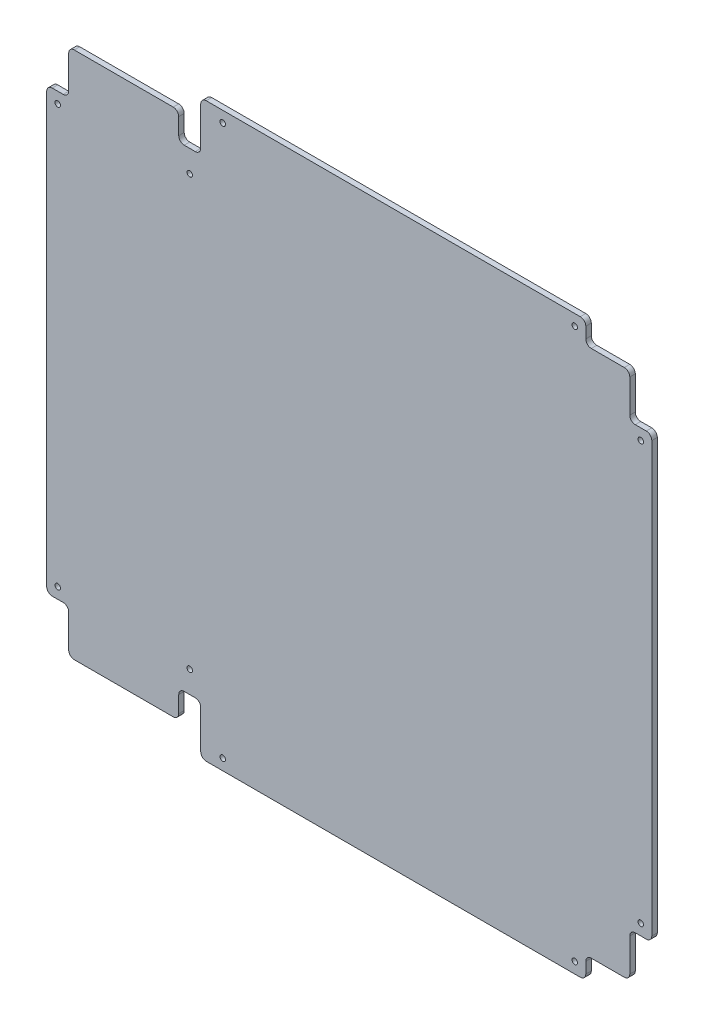
from build123d import *

# Parameters (mm, degrees)
SKETCH_1_W          = 550
SKETCH_1_H          = 520
EXTRUDE_1_DEPTH     = 5
SKETCH_2_R          = 2.5
CUT_EXTRUDE_1_DEPTH = 379.483817356
FILLET_1_R          = 5


with BuildPart() as part:
    # 草图1 → 凸台-拉伸1 (new body)
    with BuildSketch(Plane.XY):
        Rectangle(SKETCH_1_W, SKETCH_1_H)
    extrude(amount=EXTRUDE_1_DEPTH)

    # 草图2 → 切除-拉伸1 (cut, through all)
    with BuildSketch(Plane.XY.offset(5)):
        with Locations((205, 250)):
            Circle(SKETCH_2_R)
        with Locations((265, 190)):
            Circle(SKETCH_2_R)
        with Locations((-265, -190)):
            Circle(SKETCH_2_R)
        with Locations((205, -250)):
            Circle(SKETCH_2_R)
        with Locations((265, -190)):
            Circle(SKETCH_2_R)
        with Locations(Location((-265, 190, 0), (0, 0, 180))):
            Circle(SKETCH_2_R)
        with Locations((-115, 250)):
            Circle(SKETCH_2_R)
        with Locations((-115, -250)):
            Circle(SKETCH_2_R)
        with Locations((-145, -195)):
            Circle(SKETCH_2_R)
        with Locations((-145, 195)):
            Circle(SKETCH_2_R)
        Polygon((255, 240), (215, 240), (215, 260), (275, 260), (275, 200), (255, 200), align=None)
        Polygon((-255, -240), (-155, -240), (-155, -215), (-135, -215), (-135, -260), (-275, -260), (-275, -200), (-255, -200), align=None)
        Polygon((255, -240), (255, -200), (275, -200), (275, -260), (215, -260), (215, -240), align=None)
        Polygon((-275, 260), (-135, 260), (-135, 215), (-155, 215), (-155, 240), (-255, 240), (-255, 200), (-275, 200), align=None)
    extrude(amount=-CUT_EXTRUDE_1_DEPTH, mode=Mode.SUBTRACT)

    # 圆角1
    fillet_1_edges = [part.edges().sort_by_distance(p)[0] for p in [
        (215, -260, 2.5),
        (215, -240, 2.5),
        (255, -240, 2.5),
        (255, -200, 2.5),
        (275, -200, 2.5),
        (275, 200, 2.5),
        (255, 200, 2.5),
        (255, 240, 2.5),
        (215, 240, 2.5),
        (215, 260, 2.5),
        (-275, 200, 2.5),
        (-135, 260, 2.5),
        (-135, 215, 2.5),
        (-155, 215, 2.5),
        (-155, 240, 2.5),
        (-255, 240, 2.5),
        (-255, 200, 2.5),
        (-275, -200, 2.5),
        (-255, -200, 2.5),
        (-255, -240, 2.5),
        (-155, -240, 2.5),
        (-155, -215, 2.5),
        (-135, -215, 2.5),
        (-135, -260, 2.5),
    ]]
    fillet(fillet_1_edges, radius=FILLET_1_R)


solid = part.part
